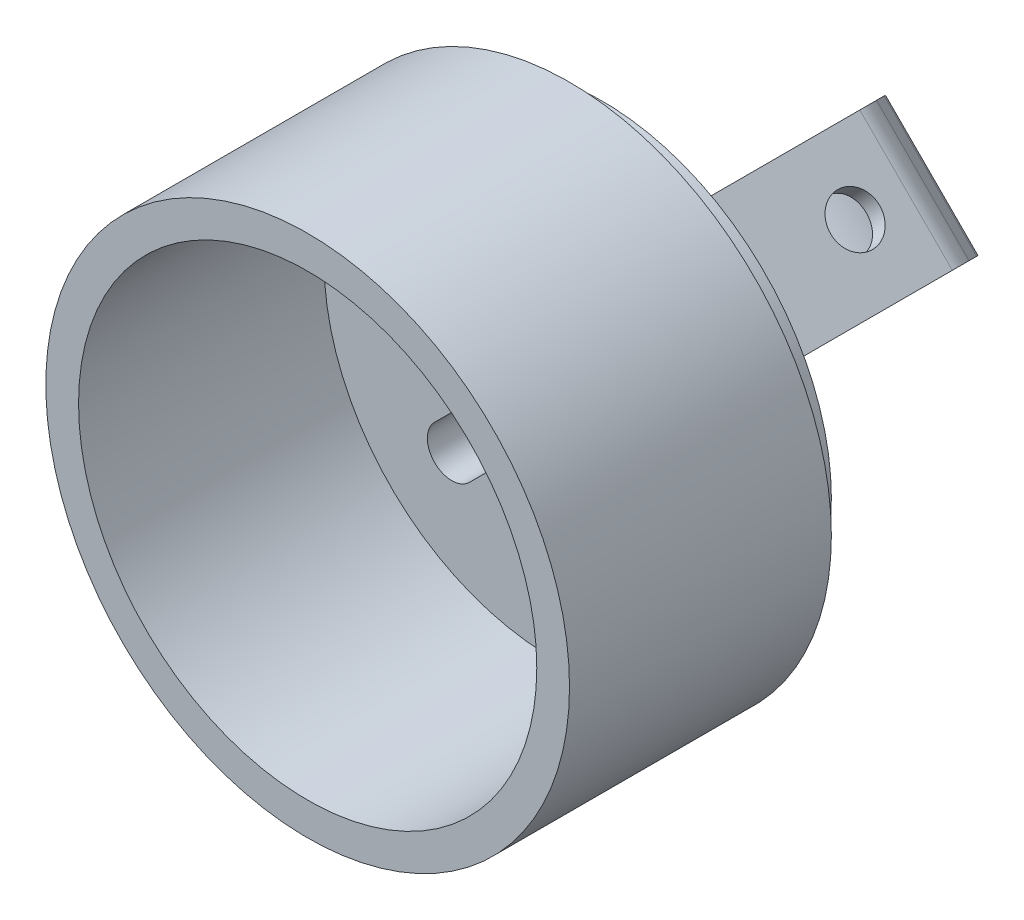
from build123d import *

# Parameters (mm, degrees)
SKETCH1_R                = 14
SKETCH1_R_2              = 1
SKETCH1_R_3              = 3
BOSS_EXTRUDE1_DEPTH      = 3
BOSS_EXTRUDE2_DEPTH      = 15
BOSS_EXTRUDE2_DEPTH_BACK = 1
SKETCH2_R                = 16
SKETCH2_R_2              = 14
SKETCH3_R                = 8.05
BOSS_EXTRUDE3_DEPTH      = 4
CUT_EXTRUDE1_DEPTH       = 10
CUT_EXTRUDE1_DEPTH_BACK  = 30
SKETCH4_R                = 2.5
SKETCH5_R                = 1.5
CUT_EXTRUDE2_DEPTH       = 37.483814873


with BuildPart() as part:
    # Sketch1 → Boss-Extrude1 (new body)
    # profile 1 of 2: a face of its own
    with BuildSketch(Plane.XY):
        Circle(SKETCH1_R)
        with Locations((0, -8)):
            Circle(SKETCH1_R_2, mode=Mode.SUBTRACT)
        with BuildLine():
            ThreePointArc((7.247844507, -5.126524164), (7.247844507, -7.247844507), (5.126524164, -7.247844507))
            Line((5.126524164, -7.247844507), (0.776457135, -2.897777479))
            ThreePointArc((0.776457135, -2.897777479), (0, -3), (-0.776457135, -2.897777479))
            Line((-0.776457135, -2.897777479), (-5.126524164, -7.247844507))
            ThreePointArc((-5.126524164, -7.247844507), (-7.247844507, -7.247844507), (-7.247844507, -5.126524164))
            Line((-7.247844507, -5.126524164), (-2.897777479, -0.776457135))
            ThreePointArc((-2.897777479, -0.776457135), (-3, 0), (-2.897777479, 0.776457135))
            Line((-2.897777479, 0.776457135), (-7.247844507, 5.126524164))
            ThreePointArc((-7.247844507, 5.126524164), (-7.247844507, 7.247844507), (-5.126524164, 7.247844507))
            Line((-5.126524164, 7.247844507), (-0.776457135, 2.897777479))
            ThreePointArc((-0.776457135, 2.897777479), (0, 3), (0.776457135, 2.897777479))
            Line((0.776457135, 2.897777479), (5.126524164, 7.247844507))
            ThreePointArc((5.126524164, 7.247844507), (7.247844507, 7.247844507), (7.247844507, 5.126524164))
            Line((7.247844507, 5.126524164), (2.897777479, 0.776457135))
            ThreePointArc((2.897777479, 0.776457135), (2.974334584, 0.391578577), (3, 0))
            ThreePointArc((3, 0), (2.974334584, -0.391578577), (2.897777479, -0.776457135))
            Line((2.897777479, -0.776457135), (7.247844507, -5.126524164))
        make_face(mode=Mode.SUBTRACT)
        with Locations((-9.5, 0)):
            Circle(SKETCH1_R_2, mode=Mode.SUBTRACT)
        with Locations((9.5, 0)):
            Circle(SKETCH1_R_2, mode=Mode.SUBTRACT)
        with Locations((0, 8)):
            Circle(SKETCH1_R_2, mode=Mode.SUBTRACT)
    # profile 2 of 2: a face of its own
    with BuildSketch(Plane.XY):
        Circle(SKETCH1_R_3)
    extrude(amount=BOSS_EXTRUDE1_DEPTH)

    # Sketch2 → Boss-Extrude2 (add, two sides: drawn at the far end of the back side and taken through both)
    with BuildSketch(Plane.XY.offset(3).offset(-BOSS_EXTRUDE2_DEPTH_BACK)):
        Circle(SKETCH2_R)
        Circle(SKETCH2_R_2, mode=Mode.SUBTRACT)
    extrude(amount=BOSS_EXTRUDE2_DEPTH + BOSS_EXTRUDE2_DEPTH_BACK)

    # Sketch3 → Boss-Extrude3 (add, symmetric)
    with BuildSketch(Plane(origin=(0, 0, 0), x_dir=(0.7071067811865477, 0.7071067811865475, 0), z_dir=(-0.7071067811865475, 0.7071067811865477, 0))):
        with BuildLine():
            Line((-9.05, 9.05), (-9.05, 0))
            Line((-9.05, 0), (9.05, 0))
            Line((9.05, 0), (9.05, 9.05))
            Line((9.05, 9.05), (9.05, 12.166022099))
            ThreePointArc((9.05, 12.166022099), (8.879286309, 12.974546435), (8.396288399, 13.645044596))
            Line((8.396288399, 13.645044596), (6.091955006, 15.742576798))
            ThreePointArc((6.091955006, 15.742576798), (0, 18.1), (-6.091955006, 15.742576798))
            Line((-6.091955006, 15.742576798), (-8.396288399, 13.645044596))
            ThreePointArc((-8.396288399, 13.645044596), (-8.879286309, 12.974546435), (-9.05, 12.166022099))
            Line((-9.05, 12.166022099), (-9.05, 9.05))
        make_face()
        with Locations(Location((0, 9.05, 0), (0, 0, 180))):
            Circle(SKETCH3_R, mode=Mode.SUBTRACT)
    extrude(amount=BOSS_EXTRUDE3_DEPTH, both=True)

    # Sketch4 → Cut-Extrude1 (cut, two sides: drawn at the far end of the back side and taken through both)
    with BuildSketch(Plane(origin=(0, 0, 0), x_dir=(-1, 0, 0), z_dir=(0, 0, -1)).offset(-CUT_EXTRUDE1_DEPTH_BACK)):
        with Locations(Location((0, 0, 0), (0, 0, 180))):
            Circle(SKETCH4_R)
    extrude(amount=CUT_EXTRUDE1_DEPTH + CUT_EXTRUDE1_DEPTH_BACK, mode=Mode.SUBTRACT)

    # Sketch5 → Cut-Extrude2 (cut, through all)
    with BuildSketch(Plane(origin=(6.39931637, 6.39931637, 0), x_dir=(0, 0, -1), z_dir=(0.7071067811865476, 0.7071067811865476, 0))):
        with Locations(Location((9.05, 0, 0), (0, 0, 90))):
            Circle(SKETCH5_R)
    extrude(amount=-CUT_EXTRUDE2_DEPTH, mode=Mode.SUBTRACT)


solid = part.part
